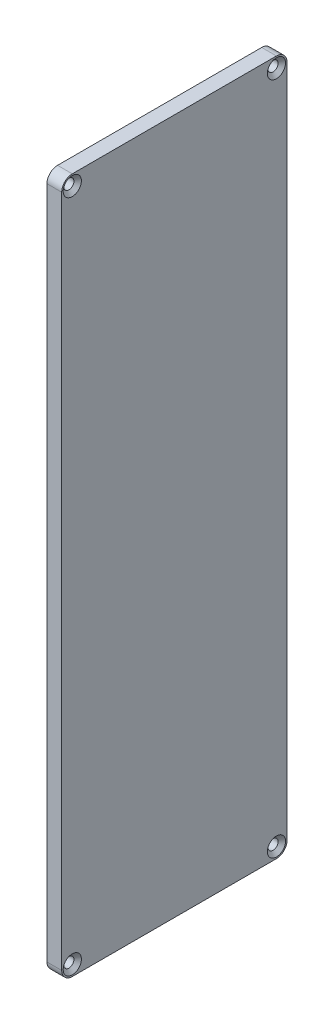
from build123d import *

# Parameters (mm, degrees)
BOSS_EXTRUDE1_DEPTH                               = 3
CSK_FOR_1_FLAT_HEAD_MACHINE_SCREW_100_D           = 2.0574
CSK_FOR_1_FLAT_HEAD_MACHINE_SCREW_100_CSINK_D     = 3.7084
CSK_FOR_1_FLAT_HEAD_MACHINE_SCREW_100_CSINK_ANGLE = 100


with BuildPart() as part:
    # Sketch1 → Boss-Extrude1 (new body)
    with BuildSketch(Plane.YZ):
        with BuildLine():
            Line((-70.802499273, 22.065445977), (-70.802499273, -19.520741015))
            ThreePointArc((-70.802499273, -19.520741015), (-70.170142814, -21.047384555), (-68.643499273, -21.679741015))
            Line((-68.643499273, -21.679741015), (68.643499273, -21.679741015))
            ThreePointArc((68.643499273, -21.679741015), (70.170142814, -21.047384555), (70.802499273, -19.520741015))
            Line((70.802499273, -19.520741015), (70.802499273, 22.065445977))
            ThreePointArc((70.802499273, 22.065445977), (70.170142814, 23.592089518), (68.643499273, 24.224445977))
            Line((68.643499273, 24.224445977), (-68.643499273, 24.224445977))
            ThreePointArc((-68.643499273, 24.224445977), (-70.170142814, 23.592089518), (-70.802499273, 22.065445977))
        make_face()
    extrude(amount=BOSS_EXTRUDE1_DEPTH)

    # CSK for #1 Flat Head Machine Screw (100)1 (through all)
    with Locations(Plane.YZ.offset(3)):
        with Locations((68.643499273, 22.065445977), (68.643499273, -19.520741015), (-68.643499273, -19.520741015), (-68.643499273, 22.065445977)):
            CounterSinkHole(CSK_FOR_1_FLAT_HEAD_MACHINE_SCREW_100_D / 2, CSK_FOR_1_FLAT_HEAD_MACHINE_SCREW_100_CSINK_D / 2, counter_sink_angle=CSK_FOR_1_FLAT_HEAD_MACHINE_SCREW_100_CSINK_ANGLE)


solid = part.part
